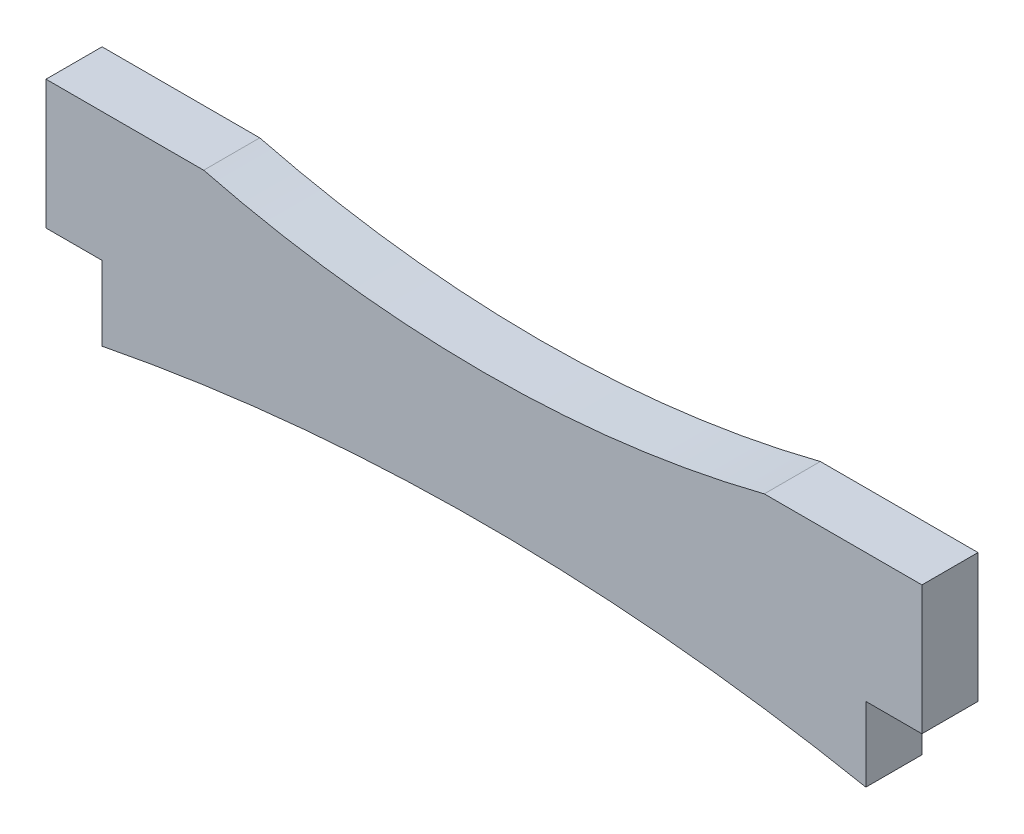
from build123d import *

# Parameters (mm, degrees)
BOSS_EXTRU_1_DEPTH = 8


with BuildPart() as part:
    # Esquisse1 → Boss.-Extru.1 (new body)
    with BuildSketch(Plane.XY):
        with BuildLine():
            Line((-62.5, 9.199052512), (-62.5, -9.199052512))
            Line((-62.5, -9.199052512), (-54.5, -9.199052512))
            Line((-54.5, -9.199052512), (-54.5, -19.800947488))
            ThreePointArc((-54.5, -19.800947488), (0, -14.5), (54.5, -19.800947488))
            Line((54.5, -19.800947488), (54.5, -9.199052512))
            Line((54.5, -9.199052512), (62.5, -9.199052512))
            Line((62.5, -9.199052512), (62.5, 9.199052512))
            Line((62.5, 9.199052512), (39.999990632, 9.199052512))
            ThreePointArc((39.999990632, 9.199052512), (-4.684e-06, 4.199052512), (-40, 9.199052512))
            Line((-40, 9.199052512), (-62.5, 9.199052512))
        make_face()
    extrude(amount=BOSS_EXTRU_1_DEPTH)


solid = part.part
